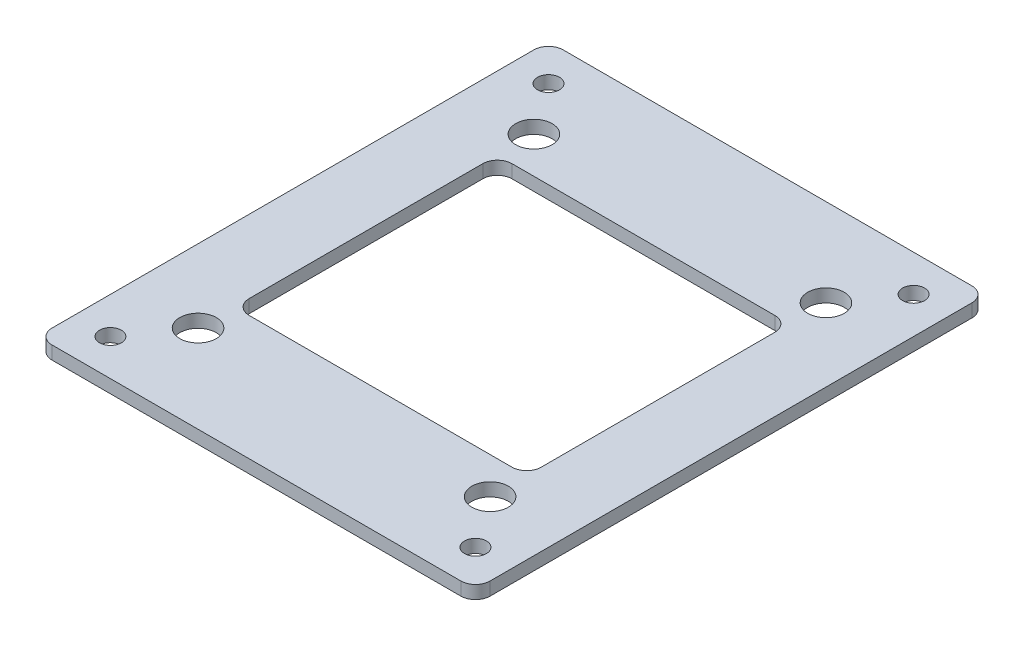
from build123d import *

# Parameters (mm, degrees)
SKETCH_1_W          = 60
SKETCH_1_H          = 70
SKETCH_1_R          = 2.5
EXTRUDE_1_DEPTH     = 1.8
SKETCH_2_R          = 1.5
SKETCH_2_W          = 40
SKETCH_2_H          = 36
CUT_EXTRUDE_1_DEPTH = 47.132851635
FILLET_1_R          = 2


with BuildPart() as part:
    # 草图1 → 凸台-拉伸1 (new body)
    with BuildSketch(Plane(origin=(0, 0, 0), x_dir=(1, 0, 0), z_dir=(0, 1, 0))):
        Rectangle(SKETCH_1_W, SKETCH_1_H)
        with Locations(Location((-20, 23, 0), (0, 0, 270))):
            Circle(SKETCH_1_R, mode=Mode.SUBTRACT)
        with Locations(Location((20, 23, 0), (0, 0, 90))):
            Circle(SKETCH_1_R, mode=Mode.SUBTRACT)
        with Locations(Location((20, -23, 0), (0, 0, 270))):
            Circle(SKETCH_1_R, mode=Mode.SUBTRACT)
        with Locations(Location((-20, -23, 0), (0, 0, 90))):
            Circle(SKETCH_1_R, mode=Mode.SUBTRACT)
    extrude(amount=EXTRUDE_1_DEPTH)

    # 草图2 → 切除-拉伸1 (cut, through all)
    with BuildSketch(Plane(origin=(0, 1.8, 0), x_dir=(1, 0, 0), z_dir=(0, 1, 0))):
        with Locations(Location((-25, 30, 0), (0, 0, 270))):
            Circle(SKETCH_2_R)
        with Locations(Location((25, 30, 0), (0, 0, 90))):
            Circle(SKETCH_2_R)
        with Locations(Location((25, -30, 0), (0, 0, 270))):
            Circle(SKETCH_2_R)
        with Locations(Location((-25, -30, 0), (0, 0, 90))):
            Circle(SKETCH_2_R)
        Rectangle(SKETCH_2_W, SKETCH_2_H)
    extrude(amount=-CUT_EXTRUDE_1_DEPTH, mode=Mode.SUBTRACT)

    # 圆角1
    fillet_1_edges = [part.edges().sort_by_distance(p)[0] for p in [
        (20, 0.9, -18),
        (20, 0.9, 18),
        (-20, 0.9, 18),
        (-20, 0.9, -18),
        (30, 0.9, 35),
        (-30, 0.9, 35),
        (-30, 0.9, -35),
        (30, 0.9, -35),
    ]]
    fillet(fillet_1_edges, radius=FILLET_1_R)


solid = part.part
